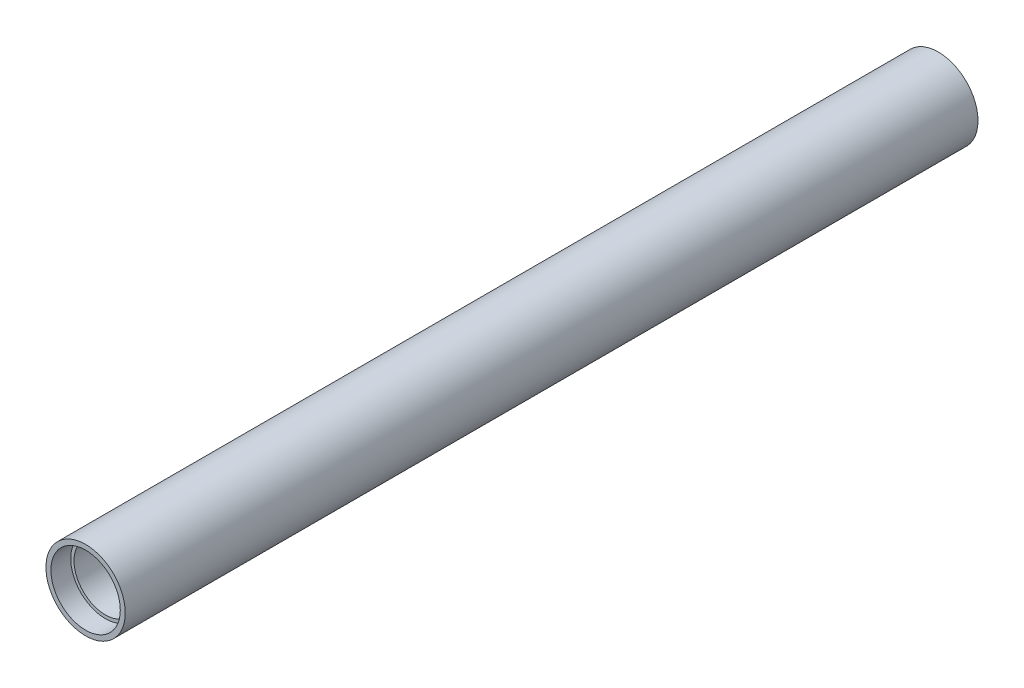
from build123d import *

# Parameters (mm, degrees)
IZIM1_R                     = 24
IZIM1_R_2                   = 19
Y_KSEKLIK_EKSTR_ZYON1_DEPTH = 516
KES_EKSTR_ZYON1_START       = -12
IZIM2_R                     = 21
IZIM2_R_2                   = 19
KES_EKSTR_ZYON1_DEPTH       = 12
IZIM3_R                     = 21
IZIM3_R_2                   = 19
KES_EKSTR_ZYON2_DEPTH       = 12


with BuildPart() as part:
    # Çizim1 → Yükseklik-Ekstrüzyon1 (new body)
    with BuildSketch(Plane.XY):
        Circle(IZIM1_R)
        Circle(IZIM1_R_2, mode=Mode.SUBTRACT)
    extrude(amount=Y_KSEKLIK_EKSTR_ZYON1_DEPTH)

    # Çizim2 → Kes-Ekstrüzyon1 (cut)
    with BuildSketch(Plane.XY.offset(516).offset(KES_EKSTR_ZYON1_START)):
        Circle(IZIM2_R)
        Circle(IZIM2_R_2, mode=Mode.SUBTRACT)
    extrude(amount=KES_EKSTR_ZYON1_DEPTH, mode=Mode.SUBTRACT)

    # Çizim3 → Kes-Ekstrüzyon2 (cut)
    with BuildSketch(Plane(origin=(0, 0, 0), x_dir=(-1, 0, 0), z_dir=(0, 0, -1))):
        with Locations(Location((0, 0, 0), (0, 0, 180))):
            Circle(IZIM3_R)
        Circle(IZIM3_R_2, mode=Mode.SUBTRACT)
    extrude(amount=-KES_EKSTR_ZYON2_DEPTH, mode=Mode.SUBTRACT)


solid = part.part
